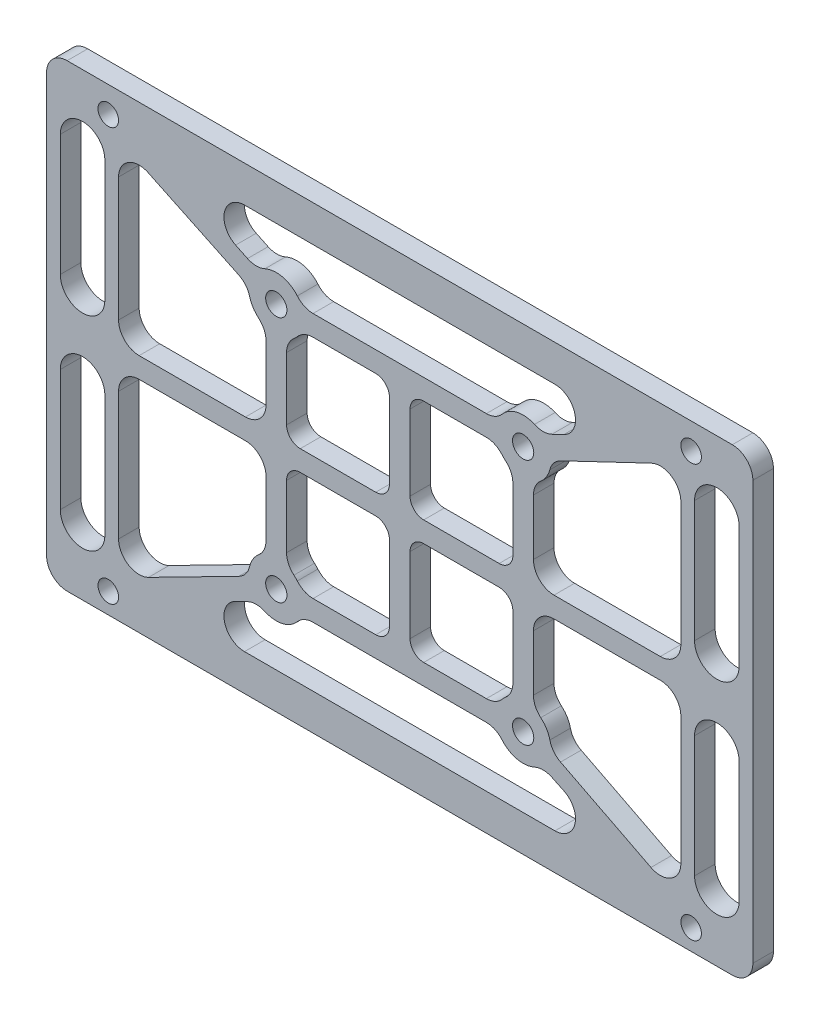
from build123d import *

# Parameters (mm, degrees)
SKETCH_1_W          = 103
SKETCH_1_H          = 67
EXTRUDE_1_DEPTH     = 3
SKETCH_2_R          = 1.55
SKETCH_2_R_2        = 1.5
CUT_EXTRUDE_1_DEPTH = 10
CUT_EXTRUDE_2_DEPTH = 10
FILLET_1_R          = 3
SKETCH_5_W          = 25.271228892
SKETCH_5_H          = 3
EXTRUDE_2_DEPTH     = 3
FILLET_2_R          = 3
CUT_EXTRUDE_3_DEPTH = 10
SKETCH_7_W          = 3
SKETCH_7_H          = 15
SKETCH_7_W_2        = 15
SKETCH_7_H_2        = 3
EXTRUDE_3_DEPTH     = 3
FILLET_3_R          = 2


with BuildPart() as part:
    # 草图1 → 凸台-拉伸1 (new body)
    with BuildSketch(Plane.XY):
        Rectangle(SKETCH_1_W, SKETCH_1_H)
    extrude(amount=EXTRUDE_1_DEPTH)

    # 草图2 → 切除-拉伸1 (cut)
    with BuildSketch(Plane.XY.offset(3)):
        with Locations((-18, 18)):
            Circle(SKETCH_2_R)
        with Locations((18, 18)):
            Circle(SKETCH_2_R)
        with Locations((18, -18)):
            Circle(SKETCH_2_R)
        with Locations((-18, -18)):
            Circle(SKETCH_2_R)
        with Locations((42.5, 29.7)):
            Circle(SKETCH_2_R_2)
        with Locations((42.5, -30.5)):
            Circle(SKETCH_2_R_2)
        with Locations((-42.499997562, -30.5)):
            Circle(SKETCH_2_R_2)
        with Locations((-42.499997562, 29.7)):
            Circle(SKETCH_2_R_2)
    extrude(amount=-CUT_EXTRUDE_1_DEPTH, mode=Mode.SUBTRACT)

    # 草图4 → 切除-拉伸2 (cut)
    with BuildSketch(Plane.XY.offset(3)):
        with BuildLine():
            Line((20.699726018, 20.951521544), (35.87816381, 28.2))
            Line((35.87816381, 28.2), (-35.878161967, 28.2))
            Line((-35.878161967, 28.2), (-20.699725904, 20.951521649))
            ThreePointArc((-20.699725904, 20.951521649), (-17.11629588, 21.901162266), (-14.291900756, 19.5))
            Line((-14.291900756, 19.5), (14.291900756, 19.5))
            ThreePointArc((14.291900756, 19.5), (17.116295955, 21.901162283), (20.699726018, 20.951521544))
        make_face()
        with BuildLine():
            Line((40.999997562, 27.321408738), (21.992528342, 18.244371513))
            ThreePointArc((21.992528342, 18.244371513), (21.383411469, 15.866334883), (19.5, 14.291900756))
            Line((19.5, 14.291900756), (19.5, -14.291900756))
            ThreePointArc((19.5, -14.291900756), (21.411123425, -15.910924372), (21.984738914, -18.349078486))
            Line((21.984738914, -18.349078486), (40.999997562, -28.050742027))
            Line((40.999997562, -28.050742027), (40.999997562, 27.321408738))
        make_face()
        with BuildLine():
            ThreePointArc((16.5, 14.291900756), (15.171572875, 15.171572875), (14.291900756, 16.5))
            Line((14.291900756, 16.5), (-14.291900756, 16.5))
            ThreePointArc((-14.291900756, 16.5), (-15.171572875, 15.171572875), (-16.5, 14.291900756))
            Line((-16.5, 14.291900756), (-16.5, -14.291900756))
            ThreePointArc((-16.5, -14.291900756), (-15.171572875, -15.171572875), (-14.291900756, -16.5))
            Line((-14.291900756, -16.5), (14.291900756, -16.5))
            ThreePointArc((14.291900756, -16.5), (15.171572875, -15.171572875), (16.5, -14.291900756))
            Line((16.5, -14.291900756), (16.5, 14.291900756))
        make_face()
        with BuildLine():
            ThreePointArc((-19.5, 14.291900756), (-21.383411469, 15.866334883), (-21.992528342, 18.244371513))
            Line((-21.992528342, 18.244371513), (-40.999997562, 27.321408738))
            Line((-40.999997562, 27.321408738), (-40.999997562, -28.050742027))
            Line((-40.999997562, -28.050742027), (-21.984738914, -18.349078486))
            ThreePointArc((-21.984738914, -18.349078486), (-21.411123425, -15.910924372), (-19.5, -14.291900756))
            Line((-19.5, -14.291900756), (-19.5, 14.291900756))
        make_face()
        with BuildLine():
            Line((35.87816381, -28.2), (20.699726018, -20.951521544))
            ThreePointArc((20.699726018, -20.951521544), (17.116295955, -21.901162283), (14.291900756, -19.5))
            Line((14.291900756, -19.5), (-14.291900756, -19.5))
            ThreePointArc((-14.291900756, -19.5), (-17.11629588, -21.901162266), (-20.699725904, -20.951521649))
            Line((-20.699725904, -20.951521649), (-35.878161967, -28.2))
            Line((-35.878161967, -28.2), (35.87816381, -28.2))
        make_face()
    extrude(amount=-CUT_EXTRUDE_2_DEPTH, mode=Mode.SUBTRACT)

    # 圆角1
    fillet_1_edges = [part.edges().sort_by_distance(p)[0] for p in [
        (16.5, -14.291900756, 1.5),
        (14.291900756, -16.5, 1.5),
        (-14.291900756, -16.5, 1.5),
        (-16.5, -14.291900756, 1.5),
        (-16.5, 14.291900756, 1.5),
        (-14.291900756, 16.5, 1.5),
        (14.291900756, 16.5, 1.5),
        (16.5, 14.291900756, 1.5),
        (14.291900756, -19.5, 1.5),
        (20.699726018, -20.951521544, 1.5),
        (35.87816381, -28.2, 1.5),
        (-35.878161967, -28.2, 1.5),
        (-20.699725904, -20.951521649, 1.5),
        (-14.291900756, -19.5, 1.5),
        (21.984738914, -18.349078486, 1.5),
        (19.5, -14.291900756, 1.5),
        (19.5, 14.291900756, 1.5),
        (21.992528342, 18.244371513, 1.5),
        (40.999997562, 27.321408738, 1.5),
        (40.999997562, -28.050742027, 1.5),
        (-19.5, -14.291900756, 1.5),
        (-21.984738914, -18.349078486, 1.5),
        (-40.999997562, -28.050742027, 1.5),
        (-40.999997562, 27.321408738, 1.5),
        (-21.992528342, 18.244371513, 1.5),
        (-19.5, 14.291900756, 1.5),
        (20.699726018, 20.951521544, 1.5),
        (14.291900756, 19.5, 1.5),
        (-14.291900756, 19.5, 1.5),
        (-20.699725904, 20.951521649, 1.5),
        (-35.878161967, 28.2, 1.5),
        (35.87816381, 28.2, 1.5),
    ]]
    fillet(fillet_1_edges, radius=FILLET_1_R)

    # 草图5 → 凸台-拉伸2 (add)
    with BuildSketch(Plane.XY.offset(3)):
        with Locations((-30.476283089, 0)):
            Rectangle(SKETCH_5_W, SKETCH_5_H)
        with Locations((30.476283089, 0)):
            Rectangle(SKETCH_5_W, SKETCH_5_H)
    extrude(amount=-EXTRUDE_2_DEPTH)

    # 圆角2
    fillet_2_edges = [part.edges().sort_by_distance(p)[0] for p in [
        (-19.5, -1.5, 1.5),
        (-19.5, 1.5, 1.5),
        (-40.999997562, 1.5, 1.5),
        (-40.999997562, -1.5, 1.5),
        (40.999997562, -1.5, 1.5),
        (40.999997562, 1.5, 1.5),
        (19.5, 1.5, 1.5),
        (19.5, -1.5, 1.5),
        (-51.5, 33.5, 1.5),
        (51.5, 33.5, 1.5),
        (51.5, -33.5, 1.5),
        (-51.5, -33.5, 1.5),
    ]]
    fillet(fillet_2_edges, radius=FILLET_2_R)

    # 草图6 → 切除-拉伸3 (cut)
    with BuildSketch(Plane.XY.offset(3)):
        with BuildLine():
            Line((-42.999997562, 23.7), (-42.999997562, 6))
            ThreePointArc((-42.999997562, 6), (-46.249998781, 2.749998781), (-49.5, 6))
            Line((-49.5, 6), (-49.5, 23.7))
            ThreePointArc((-49.5, 23.7), (-46.249998781, 26.950001219), (-42.999997562, 23.7))
        make_face()
        with BuildLine():
            Line((42.999997562, 23.7), (42.999997562, 6))
            ThreePointArc((42.999997562, 6), (46.249998781, 2.749998781), (49.5, 6))
            Line((49.5, 6), (49.5, 23.7))
            ThreePointArc((49.5, 23.7), (46.249998781, 26.950001219), (42.999997562, 23.7))
        make_face()
        with BuildLine():
            Line((42.999997562, -23.7), (42.999997562, -6))
            ThreePointArc((42.999997562, -6), (46.249998781, -2.749998781), (49.5, -6))
            Line((49.5, -6), (49.5, -23.7))
            ThreePointArc((49.5, -23.7), (46.249998781, -26.950001219), (42.999997562, -23.7))
        make_face()
        with BuildLine():
            Line((-42.999997562, -23.7), (-42.999997562, -6))
            ThreePointArc((-42.999997562, -6), (-46.249998781, -2.749998781), (-49.5, -6))
            Line((-49.5, -6), (-49.5, -23.7))
            ThreePointArc((-49.5, -23.7), (-46.249998781, -26.950001219), (-42.999997562, -23.7))
        make_face()
    extrude(amount=-CUT_EXTRUDE_3_DEPTH, mode=Mode.SUBTRACT)

    # 草图7 → 凸台-拉伸3 (add)
    with BuildSketch(Plane.XY.offset(3)):
        with Locations((0, 9)):
            Rectangle(SKETCH_7_W, SKETCH_7_H)
        with Locations((-9, 0)):
            Rectangle(SKETCH_7_W_2, SKETCH_7_H_2)
        Rectangle(SKETCH_7_W, SKETCH_7_H_2)
        with Locations((9, 0)):
            Rectangle(SKETCH_7_W_2, SKETCH_7_H_2)
        with Locations((0, -9)):
            Rectangle(SKETCH_7_W, SKETCH_7_H)
    extrude(amount=-EXTRUDE_3_DEPTH)

    # 圆角3
    fillet_3_edges = [part.edges().sort_by_distance(p)[0] for p in [
        (1.5, 16.5, 1.5),
        (1.5, 1.5, 1.5),
        (16.5, 1.5, 1.5),
        (16.5, -1.5, 1.5),
        (1.5, -1.5, 1.5),
        (1.5, -16.5, 1.5),
        (-1.5, -16.5, 1.5),
        (-1.5, -1.5, 1.5),
        (-16.5, -1.5, 1.5),
        (-16.5, 1.5, 1.5),
        (-1.5, 1.5, 1.5),
        (-1.5, 16.5, 1.5),
    ]]
    fillet(fillet_3_edges, radius=FILLET_3_R)


solid = part.part
